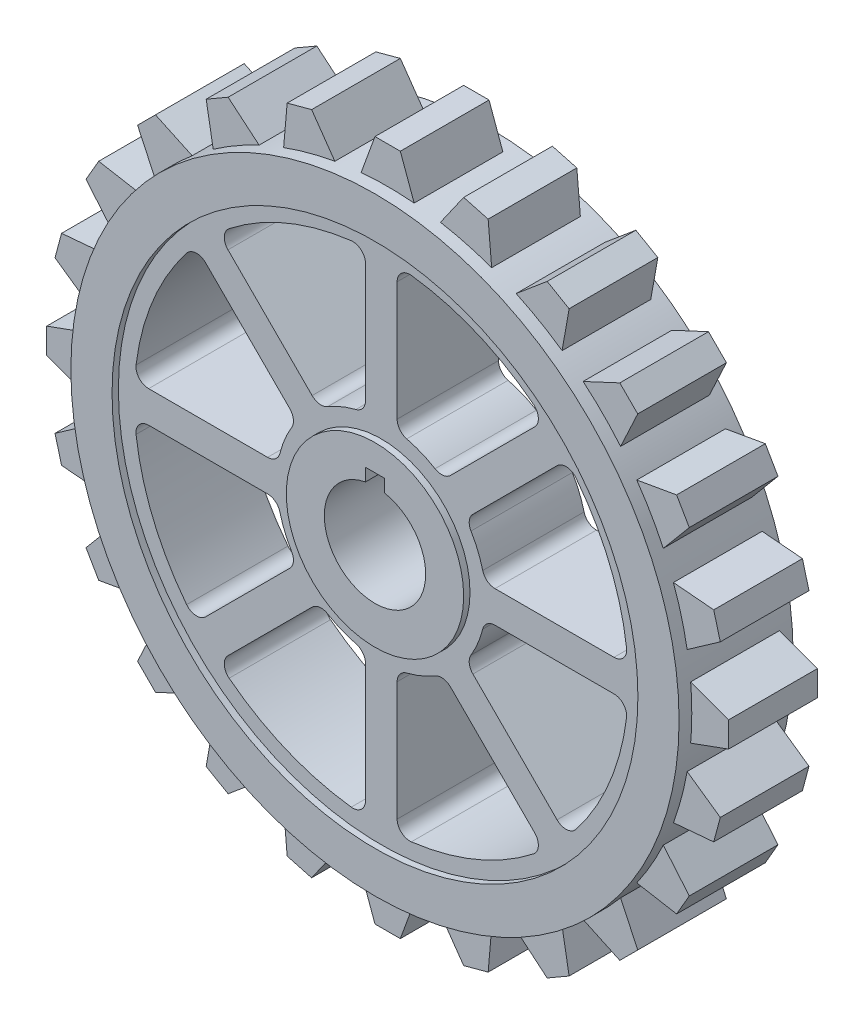
from build123d import *

# Parameters (mm, degrees)
BOSS_EXTRUDE1_DEPTH        = 16
BOSS_EXTRUDE1_DEPTH_BACK   = 2
SKETCH1_R                  = 48
SKETCH1_R_2                = 41.5
BOSS_EXTRUDE1_2_DEPTH      = 16
BOSS_EXTRUDE1_2_DEPTH_BACK = 2
SKETCH1_R_3                = 14
BOSS_EXTRUDE2_DEPTH        = 15
BOSS_EXTRUDE2_DEPTH_BACK   = 1
SKETCH1_3_R                = 41.5
SKETCH1_3_R_2              = 14
BOSS_EXTRUDE3_DEPTH        = 14


with BuildPart() as part:
    # Sketch1 → Boss-Extrude1 (new, two sides: drawn at the far end of the back side and taken through both)
    with BuildSketch(Plane.XY.offset(-BOSS_EXTRUDE1_DEPTH_BACK)):
        Circle(SKETCH1_R)
        Circle(SKETCH1_R_2, mode=Mode.SUBTRACT)
    extrude(amount=BOSS_EXTRUDE1_DEPTH + BOSS_EXTRUDE1_DEPTH_BACK)



with BuildPart() as body_2:
    # Sketch1 → Boss-Extrude1 2 (new, two sides: drawn at the far end of the back side and taken through both)
    with BuildSketch(Plane.XY.offset(-BOSS_EXTRUDE1_2_DEPTH_BACK)):
        Circle(SKETCH1_R_3)
        with BuildLine():
            Line((-1.5, 9.867742775), (1.5, 9.867742775))
            Line((1.5, 9.867742775), (1.5, 7.858116823))
            ThreePointArc((1.5, 7.858116823), (0, -8), (-1.5, 7.858116823))
            Line((-1.5, 7.858116823), (-1.5, 9.867742775))
        make_face(mode=Mode.SUBTRACT)
    extrude(amount=BOSS_EXTRUDE1_2_DEPTH + BOSS_EXTRUDE1_2_DEPTH_BACK)


with BuildPart() as part_1:
    add(part.part)

    add(body_2.part)  # Boss-Extrude2 merges body 2
    # Sketch1<3> → Boss-Extrude2 (add, two sides: drawn at the far end of the back side and taken through both)
    with BuildSketch(Plane.XY.offset(-BOSS_EXTRUDE2_DEPTH_BACK)):
        Circle(SKETCH1_3_R)
        with BuildLine():
            Line((-2.5, -17.944358445), (-2.5, -36.725331857))
            ThreePointArc((-2.5, -36.725331857), (-3.174572991, -38.223077911), (-4.743243243, -38.71048493))
            ThreePointArc((-4.743243243, -38.71048493), (-14.924653862, -36.031301768), (-24.018466935, -30.726425859))
            ThreePointArc((-24.018466935, -30.726425859), (-24.7830355, -29.272559678), (-24.200964244, -27.73649815))
            Line((-24.200964244, -27.73649815), (-10.920810587, -14.456344493))
            ThreePointArc((-10.920810587, -14.456344493), (-9.751687534, -13.885632203), (-8.478856806, -14.15482205))
            ThreePointArc((-8.478856806, -14.15482205), (-6.314276634, -15.244012286), (-4.013513514, -16.004427802))
            ThreePointArc((-4.013513514, -16.004427802), (-2.923140309, -16.714109074), (-2.5, -17.944358445))
        make_face(mode=Mode.SUBTRACT)
        with BuildLine():
            Line((-14.456344493, -10.920810587), (-27.73649815, -24.200964244))
            ThreePointArc((-27.73649815, -24.200964244), (-29.272559678, -24.7830355), (-30.726425859, -24.018466935))
            ThreePointArc((-30.726425859, -24.018466935), (-36.031301768, -14.924653862), (-38.71048493, -4.743243243))
            ThreePointArc((-38.71048493, -4.743243243), (-38.223077911, -3.174572991), (-36.725331857, -2.5))
            Line((-36.725331857, -2.5), (-17.944358445, -2.5))
            ThreePointArc((-17.944358445, -2.5), (-16.714109074, -2.923140309), (-16.004427802, -4.013513514))
            ThreePointArc((-16.004427802, -4.013513514), (-15.244012286, -6.314276634), (-14.15482205, -8.478856806))
            ThreePointArc((-14.15482205, -8.478856806), (-13.885632203, -9.751687534), (-14.456344493, -10.920810587))
        make_face(mode=Mode.SUBTRACT)
        with BuildLine():
            Line((10.920810587, -14.456344493), (24.200964244, -27.73649815))
            ThreePointArc((24.200964244, -27.73649815), (24.7830355, -29.272559678), (24.018466935, -30.726425859))
            ThreePointArc((24.018466935, -30.726425859), (14.924653862, -36.031301768), (4.743243243, -38.71048493))
            ThreePointArc((4.743243243, -38.71048493), (3.174572991, -38.223077911), (2.5, -36.725331857))
            Line((2.5, -36.725331857), (2.5, -17.944358445))
            ThreePointArc((2.5, -17.944358445), (2.923140309, -16.714109074), (4.013513514, -16.004427802))
            ThreePointArc((4.013513514, -16.004427802), (6.314276634, -15.244012286), (8.478856806, -14.15482205))
            ThreePointArc((8.478856806, -14.15482205), (9.751687534, -13.885632203), (10.920810587, -14.456344493))
        make_face(mode=Mode.SUBTRACT)
        with BuildLine():
            Line((17.944358445, -2.5), (36.725331857, -2.5))
            ThreePointArc((36.725331857, -2.5), (38.223077911, -3.174572991), (38.71048493, -4.743243243))
            ThreePointArc((38.71048493, -4.743243243), (36.031301768, -14.924653862), (30.726425859, -24.018466935))
            ThreePointArc((30.726425859, -24.018466935), (29.272559678, -24.7830355), (27.73649815, -24.200964244))
            Line((27.73649815, -24.200964244), (14.456344493, -10.920810587))
            ThreePointArc((14.456344493, -10.920810587), (13.885632203, -9.751687534), (14.15482205, -8.478856806))
            ThreePointArc((14.15482205, -8.478856806), (15.244012286, -6.314276634), (16.004427802, -4.013513514))
            ThreePointArc((16.004427802, -4.013513514), (16.714109074, -2.923140309), (17.944358445, -2.5))
        make_face(mode=Mode.SUBTRACT)
        with BuildLine():
            Line((-17.944358445, 2.5), (-36.725331857, 2.5))
            ThreePointArc((-36.725331857, 2.5), (-38.223077911, 3.174572991), (-38.71048493, 4.743243243))
            ThreePointArc((-38.71048493, 4.743243243), (-36.031301768, 14.924653862), (-30.726425859, 24.018466935))
            ThreePointArc((-30.726425859, 24.018466935), (-29.272559678, 24.7830355), (-27.73649815, 24.200964244))
            Line((-27.73649815, 24.200964244), (-14.456344493, 10.920810587))
            ThreePointArc((-14.456344493, 10.920810587), (-13.885632203, 9.751687534), (-14.15482205, 8.478856806))
            ThreePointArc((-14.15482205, 8.478856806), (-15.244012286, 6.314276634), (-16.004427802, 4.013513514))
            ThreePointArc((-16.004427802, 4.013513514), (-16.714109074, 2.923140309), (-17.944358445, 2.5))
        make_face(mode=Mode.SUBTRACT)
        with BuildLine():
            ThreePointArc((-4.743243243, 38.71048493), (-3.174572991, 38.223077911), (-2.5, 36.725331857))
            Line((-2.5, 36.725331857), (-2.5, 17.944358445))
            ThreePointArc((-2.5, 17.944358445), (-2.923140309, 16.714109074), (-4.013513514, 16.004427802))
            ThreePointArc((-4.013513514, 16.004427802), (-6.314276634, 15.244012286), (-8.478856806, 14.15482205))
            ThreePointArc((-8.478856806, 14.15482205), (-9.751687534, 13.885632203), (-10.920810587, 14.456344493))
            Line((-10.920810587, 14.456344493), (-24.200964244, 27.73649815))
            ThreePointArc((-24.200964244, 27.73649815), (-24.7830355, 29.272559678), (-24.018466935, 30.726425859))
            ThreePointArc((-24.018466935, 30.726425859), (-14.924653862, 36.031301768), (-4.743243243, 38.71048493))
        make_face(mode=Mode.SUBTRACT)
        Circle(SKETCH1_3_R_2, mode=Mode.SUBTRACT)
        with BuildLine():
            Line((14.456344493, 10.920810587), (27.73649815, 24.200964244))
            ThreePointArc((27.73649815, 24.200964244), (29.272559678, 24.7830355), (30.726425859, 24.018466935))
            ThreePointArc((30.726425859, 24.018466935), (36.031301768, 14.924653862), (38.71048493, 4.743243243))
            ThreePointArc((38.71048493, 4.743243243), (38.223077911, 3.174572991), (36.725331857, 2.5))
            Line((36.725331857, 2.5), (17.944358445, 2.5))
            ThreePointArc((17.944358445, 2.5), (16.714109074, 2.923140309), (16.004427802, 4.013513514))
            ThreePointArc((16.004427802, 4.013513514), (15.244012286, 6.314276634), (14.15482205, 8.478856806))
            ThreePointArc((14.15482205, 8.478856806), (13.885632203, 9.751687534), (14.456344493, 10.920810587))
        make_face(mode=Mode.SUBTRACT)
        with BuildLine():
            Line((2.5, 17.944358445), (2.5, 36.725331857))
            ThreePointArc((2.5, 36.725331857), (3.174572991, 38.223077911), (4.743243243, 38.71048493))
            ThreePointArc((4.743243243, 38.71048493), (14.924653862, 36.031301768), (24.018466935, 30.726425859))
            ThreePointArc((24.018466935, 30.726425859), (24.7830355, 29.272559678), (24.200964244, 27.73649815))
            Line((24.200964244, 27.73649815), (10.920810587, 14.456344493))
            ThreePointArc((10.920810587, 14.456344493), (9.751687534, 13.885632203), (8.478856806, 14.15482205))
            ThreePointArc((8.478856806, 14.15482205), (6.314276634, 15.244012286), (4.013513514, 16.004427802))
            ThreePointArc((4.013513514, 16.004427802), (2.923140309, 16.714109074), (2.5, 17.944358445))
        make_face(mode=Mode.SUBTRACT)
    extrude(amount=BOSS_EXTRUDE2_DEPTH + BOSS_EXTRUDE2_DEPTH_BACK)

    # Sketch1<4> → Boss-Extrude3 (add)
    with BuildSketch(Plane.XY):
        with BuildLine():
            Line((2, 53.817315258), (-2, 53.817315258))
            Line((-2, 53.817315258), (-4.183821406, 47.817315258))
            ThreePointArc((-4.183821406, 47.817315258), (0, 48), (4.183821406, 47.817315258))
            Line((4.183821406, 47.817315258), (2, 53.817315258))
        make_face()
        with BuildLine():
            ThreePointArc((-16.417293023, 45.10512709), (-12.423314165, 46.364439662), (-8.334770726, 47.270832412))
            Line((-8.334770726, 47.270832412), (-11.997094492, 52.501172799))
            Line((-11.997094492, 52.501172799), (-15.860797798, 51.465896619))
            Line((-15.860797798, 51.465896619), (-16.417293023, 45.10512709))
        make_face()
        with BuildLine():
            Line((11.997094492, 52.501172799), (8.334770726, 47.270832412))
            ThreePointArc((8.334770726, 47.270832412), (12.423314165, 46.364439662), (16.417293023, 45.10512709))
            Line((16.417293023, 45.10512709), (15.860797798, 51.465896619))
            Line((15.860797798, 51.465896619), (11.997094492, 52.501172799))
        make_face()
        with BuildLine():
            ThreePointArc((-27.531953251, 39.319099051), (-24, 41.569219382), (-20.285362007, 43.502920457))
            Line((-20.285362007, 43.502920457), (-25.176606821, 47.607162177))
            Line((-25.176606821, 47.607162177), (-28.640708436, 45.607162177))
            Line((-28.640708436, 45.607162177), (-27.531953251, 39.319099051))
        make_face()
        with BuildLine():
            Line((25.176606821, 47.607162177), (20.285362007, 43.502920457))
            ThreePointArc((20.285362007, 43.502920457), (24, 41.569219382), (27.531953251, 39.319099051))
            Line((27.531953251, 39.319099051), (28.640708436, 45.607162177))
            Line((28.640708436, 45.607162177), (25.176606821, 47.607162177))
        make_face()
        with BuildLine():
            ThreePointArc((-36.770356364, 30.85353939), (-33.941125497, 33.941125497), (-30.85353939, 36.770356364))
            Line((-30.85353939, 36.770356364), (-36.640375002, 39.468802126))
            Line((-36.640375002, 39.468802126), (-39.468802126, 36.640375002))
            Line((-39.468802126, 36.640375002), (-36.770356364, 30.85353939))
        make_face()
        with BuildLine():
            Line((36.640375002, 39.468802126), (30.85353939, 36.770356364))
            ThreePointArc((30.85353939, 36.770356364), (33.941125497, 33.941125497), (36.770356364, 30.85353939))
            Line((36.770356364, 30.85353939), (39.468802126, 36.640375002))
            Line((39.468802126, 36.640375002), (36.640375002, 39.468802126))
        make_face()
        with BuildLine():
            ThreePointArc((-43.502920457, 20.285362007), (-41.569219382, 24), (-39.319099051, 27.531953251))
            Line((-39.319099051, 27.531953251), (-45.607162177, 28.640708436))
            Line((-45.607162177, 28.640708436), (-47.607162177, 25.176606821))
            Line((-47.607162177, 25.176606821), (-43.502920457, 20.285362007))
        make_face()
        with BuildLine():
            Line((45.607162177, 28.640708436), (39.319099051, 27.531953251))
            ThreePointArc((39.319099051, 27.531953251), (41.569219382, 24), (43.502920457, 20.285362007))
            Line((43.502920457, 20.285362007), (47.607162177, 25.176606821))
            Line((47.607162177, 25.176606821), (45.607162177, 28.640708436))
        make_face()
        with BuildLine():
            ThreePointArc((-47.270832412, 8.334770726), (-46.364439662, 12.423314165), (-45.10512709, 16.417293023))
            Line((-45.10512709, 16.417293023), (-51.465896619, 15.860797798))
            Line((-51.465896619, 15.860797798), (-52.501172799, 11.997094492))
            Line((-52.501172799, 11.997094492), (-47.270832412, 8.334770726))
        make_face()
        with BuildLine():
            Line((51.465896619, 15.860797798), (45.10512709, 16.417293023))
            ThreePointArc((45.10512709, 16.417293023), (46.364439662, 12.423314165), (47.270832412, 8.334770726))
            Line((47.270832412, 8.334770726), (52.501172799, 11.997094492))
            Line((52.501172799, 11.997094492), (51.465896619, 15.860797798))
        make_face()
        with BuildLine():
            ThreePointArc((-47.817315258, -4.183821406), (-48, 0), (-47.817315258, 4.183821406))
            Line((-47.817315258, 4.183821406), (-53.817315258, 2))
            Line((-53.817315258, 2), (-53.817315258, -2))
            Line((-53.817315258, -2), (-47.817315258, -4.183821406))
        make_face()
        with BuildLine():
            Line((53.817315258, 2), (47.817315258, 4.183821406))
            ThreePointArc((47.817315258, 4.183821406), (48, 0), (47.817315258, -4.183821406))
            Line((47.817315258, -4.183821406), (53.817315258, -2))
            Line((53.817315258, -2), (53.817315258, 2))
        make_face()
        with BuildLine():
            ThreePointArc((-45.10512709, -16.417293023), (-46.364439662, -12.423314165), (-47.270832412, -8.334770726))
            Line((-47.270832412, -8.334770726), (-52.501172799, -11.997094492))
            Line((-52.501172799, -11.997094492), (-51.465896619, -15.860797798))
            Line((-51.465896619, -15.860797798), (-45.10512709, -16.417293023))
        make_face()
        with BuildLine():
            Line((52.501172799, -11.997094492), (47.270832412, -8.334770726))
            ThreePointArc((47.270832412, -8.334770726), (46.364439662, -12.423314165), (45.10512709, -16.417293023))
            Line((45.10512709, -16.417293023), (51.465896619, -15.860797798))
            Line((51.465896619, -15.860797798), (52.501172799, -11.997094492))
        make_face()
        with BuildLine():
            ThreePointArc((-39.319099051, -27.531953251), (-41.569219382, -24), (-43.502920457, -20.285362007))
            Line((-43.502920457, -20.285362007), (-47.607162177, -25.176606821))
            Line((-47.607162177, -25.176606821), (-45.607162177, -28.640708436))
            Line((-45.607162177, -28.640708436), (-39.319099051, -27.531953251))
        make_face()
        with BuildLine():
            Line((47.607162177, -25.176606821), (43.502920457, -20.285362007))
            ThreePointArc((43.502920457, -20.285362007), (41.569219382, -24), (39.319099051, -27.531953251))
            Line((39.319099051, -27.531953251), (45.607162177, -28.640708436))
            Line((45.607162177, -28.640708436), (47.607162177, -25.176606821))
        make_face()
        with BuildLine():
            ThreePointArc((-30.85353939, -36.770356364), (-33.941125497, -33.941125497), (-36.770356364, -30.85353939))
            Line((-36.770356364, -30.85353939), (-39.468802126, -36.640375002))
            Line((-39.468802126, -36.640375002), (-36.640375002, -39.468802126))
            Line((-36.640375002, -39.468802126), (-30.85353939, -36.770356364))
        make_face()
        with BuildLine():
            Line((39.468802126, -36.640375002), (36.770356364, -30.85353939))
            ThreePointArc((36.770356364, -30.85353939), (33.941125497, -33.941125497), (30.85353939, -36.770356364))
            Line((30.85353939, -36.770356364), (36.640375002, -39.468802126))
            Line((36.640375002, -39.468802126), (39.468802126, -36.640375002))
        make_face()
        with BuildLine():
            ThreePointArc((-20.285362007, -43.502920457), (-24, -41.569219382), (-27.531953251, -39.319099051))
            Line((-27.531953251, -39.319099051), (-28.640708436, -45.607162177))
            Line((-28.640708436, -45.607162177), (-25.176606821, -47.607162177))
            Line((-25.176606821, -47.607162177), (-20.285362007, -43.502920457))
        make_face()
        with BuildLine():
            Line((28.640708436, -45.607162177), (27.531953251, -39.319099051))
            ThreePointArc((27.531953251, -39.319099051), (24, -41.569219382), (20.285362007, -43.502920457))
            Line((20.285362007, -43.502920457), (25.176606821, -47.607162177))
            Line((25.176606821, -47.607162177), (28.640708436, -45.607162177))
        make_face()
        with BuildLine():
            ThreePointArc((-8.334770726, -47.270832412), (-12.423314165, -46.364439662), (-16.417293023, -45.10512709))
            Line((-16.417293023, -45.10512709), (-15.860797798, -51.465896619))
            Line((-15.860797798, -51.465896619), (-11.997094492, -52.501172799))
            Line((-11.997094492, -52.501172799), (-8.334770726, -47.270832412))
        make_face()
        with BuildLine():
            Line((15.860797798, -51.465896619), (16.417293023, -45.10512709))
            ThreePointArc((16.417293023, -45.10512709), (12.423314165, -46.364439662), (8.334770726, -47.270832412))
            Line((8.334770726, -47.270832412), (11.997094492, -52.501172799))
            Line((11.997094492, -52.501172799), (15.860797798, -51.465896619))
        make_face()
        with BuildLine():
            ThreePointArc((4.183821406, -47.817315258), (0, -48), (-4.183821406, -47.817315258))
            Line((-4.183821406, -47.817315258), (-2, -53.817315258))
            Line((-2, -53.817315258), (2, -53.817315258))
            Line((2, -53.817315258), (4.183821406, -47.817315258))
        make_face()
    extrude(amount=BOSS_EXTRUDE3_DEPTH)


solid = part_1.part
